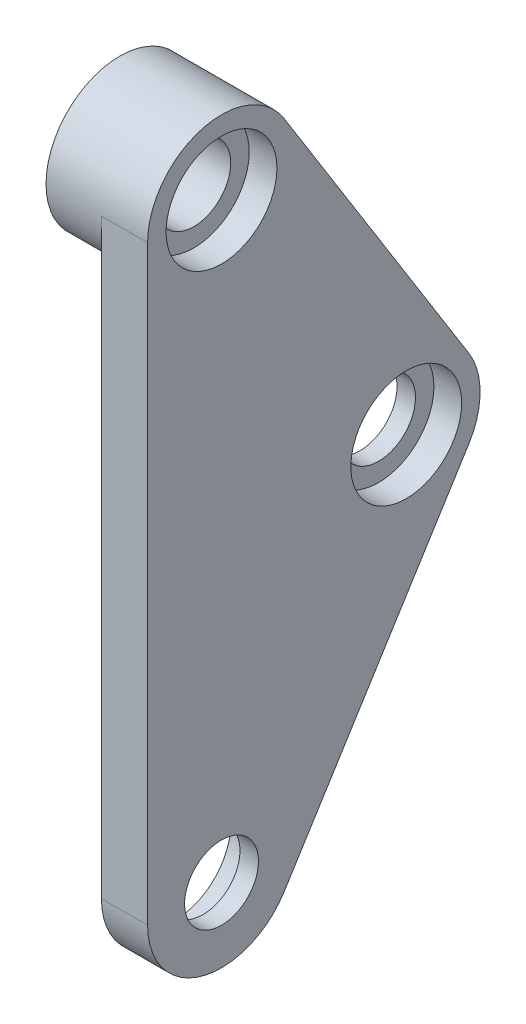
from build123d import *
from build123d.topology import SkipClean

# Parameters (mm, degrees)
EXTRUDE_1_DEPTH          = 2.5
EXTRUDE_START            = -3
SKETCH_1_4_R             = 4
EXTRUDE_2_DEPTH          = 3
CUT_EXTRUDE_1_DEPTH      = 44.965895874
CUT_EXTRUDE_1_DEPTH_BACK = 44.965895874
SKETCH_1_3_R             = 2
SKETCH_2_R               = 3
CUT_EXTRUDE_2_DEPTH      = 1.5
CUT_EXTRUDE_START        = -2.5
SKETCH_2_3_R             = 3
CUT_EXTRUDE_3_DEPTH      = 1.5
SKETCH_3_OUTSIDE_W       = 24.15
SKETCH_3_OUTSIDE_H       = 51.15
SKETCH_3_OUTSIDE_W_2     = 7.983418506
SKETCH_3_OUTSIDE_H_2     = 52.149860593
CUT_EXTRUDE_4_DEPTH      = 45.988887517


with BuildPart() as part:
    # 草图1 → 凸台-拉伸1 (new body)
    with BuildSketch(Plane(origin=(0, 0, 0), x_dir=(0, 0, -1), z_dir=(1, 0, 0))):
        with BuildLine():
            Line((17.391993216, -17.88000424), (7.391993216, -1.88000424))
            ThreePointArc((7.391993216, -1.88000424), (2.897269948, -0.155005015), (0, -4))
            Line((0, -4), (0, -36))
            ThreePointArc((0, -36), (2.897269948, -39.844994985), (7.391993216, -38.11999576))
            Line((7.391993216, -38.11999576), (17.391993216, -22.11999576))
            ThreePointArc((17.391993216, -22.11999576), (18, -20), (17.391993216, -17.88000424))
        make_face()
    extrude(amount=EXTRUDE_1_DEPTH)

    # 草图1<4> → 凸台-拉伸2 (add)
    with SkipClean():  # the faces are left unmerged after this step: merging them gives an invalid solid
        with BuildSketch(Plane(origin=(0, 0, 0), x_dir=(0, 0, -1), z_dir=(1, 0, 0)).offset(EXTRUDE_START)):
            with Locations(Location((4, -4, 0), (0, 0, 180))):
                Circle(SKETCH_1_4_R)
        extrude(amount=EXTRUDE_2_DEPTH)

    # 草图1<3> → 切除-拉伸1 (cut, two sides: drawn at the far end of the back side and taken through both)
    with SkipClean():  # the faces are left unmerged after this step: merging them gives an invalid solid
        with BuildSketch(Plane(origin=(0, 0, 0), x_dir=(0, 0, -1), z_dir=(1, 0, 0)).offset(-CUT_EXTRUDE_1_DEPTH_BACK)):
            with Locations((4, -4)):
                Circle(SKETCH_1_3_R)
            with Locations((14, -20)):
                Circle(SKETCH_1_3_R)
            with Locations((4, -36)):
                Circle(SKETCH_1_3_R)
        extrude(amount=CUT_EXTRUDE_1_DEPTH + CUT_EXTRUDE_1_DEPTH_BACK, mode=Mode.SUBTRACT)

    # 草图2 → 切除-拉伸2 (cut)
    with SkipClean():  # the faces are left unmerged after this step: merging them gives an invalid solid
        with BuildSketch(Plane(origin=(2.5, 0, 0), x_dir=(0, 0, -1), z_dir=(1, 0, 0))):
            with Locations((4, -4)):
                Circle(SKETCH_2_R)
            with Locations((14, -20)):
                Circle(SKETCH_2_R)
        extrude(amount=-CUT_EXTRUDE_2_DEPTH, mode=Mode.SUBTRACT)

    # 草图2<3> → 切除-拉伸3 (cut)
    with SkipClean():  # the faces are left unmerged after this step: merging them gives an invalid solid
        with BuildSketch(Plane(origin=(2.5, 0, 0), x_dir=(0, 0, -1), z_dir=(1, 0, 0)).offset(CUT_EXTRUDE_START)):
            with Locations((4, -36)):
                Circle(SKETCH_2_3_R)
        extrude(amount=CUT_EXTRUDE_3_DEPTH, mode=Mode.SUBTRACT)


with BuildPart() as body_2:
    # 镜向2: mirrored copy
    add(part.part.mirror(Plane(origin=(3.5, 0, 0), x_dir=(0, 0, 1), z_dir=(1, 0, 0))))

    # 草图3 outside → 切除-拉伸4 (cut, through all)
    with BuildSketch(Plane.XY):
        with Locations((3.5, -20)):
            Rectangle(SKETCH_3_OUTSIDE_W, SKETCH_3_OUTSIDE_H)
        with Locations((-0.565425098, -20.529857361)):
            Rectangle(SKETCH_3_OUTSIDE_W_2, SKETCH_3_OUTSIDE_H_2, mode=Mode.SUBTRACT)
    extrude(amount=-CUT_EXTRUDE_4_DEPTH, mode=Mode.SUBTRACT)


solid = part.part
